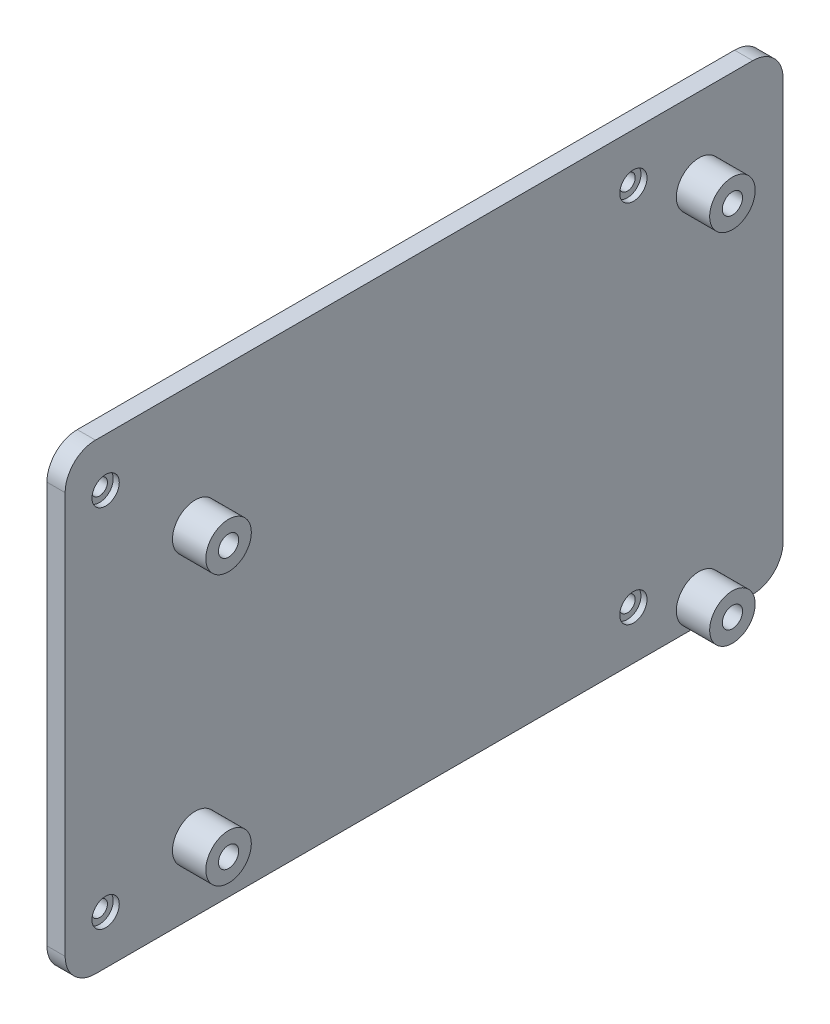
from build123d import *

# Parameters (mm, degrees)
SKETCH1_W            = 133.35
SKETCH1_H            = 76.2
BOSS_EXTRUDE1_DEPTH  = 3
M2_CLEARANCE_HOLE1_D = 2.6
SKETCH7_R            = 3.75
SKETCH7_R_2          = 1.665
BOSS_EXTRUDE2_DEPTH  = 5.5
CUT_EXTRUDE1_DEPTH   = 77.989711163
FILLET1_R            = 5
SKETCH9_R            = 2.25
CUT_EXTRUDE2_DEPTH   = 1


with BuildPart() as part:
    # Sketch1 → Boss-Extrude1 (new body)
    with BuildSketch(Plane(origin=(0, 0, 0), x_dir=(0, 0, -1), z_dir=(1, 0, 0))):
        Rectangle(SKETCH1_W, SKETCH1_H)
    extrude(amount=BOSS_EXTRUDE1_DEPTH)

    # M2 Clearance Hole1 (through all)
    with Locations(Plane(origin=(3, 0, 0), x_dir=(0, 0, -1), z_dir=(1, 0, 0))):
        with Locations((-45, -30.1), (-45, 30.1), (42, 30.1), (42, -30.1)):
            Hole(M2_CLEARANCE_HOLE1_D / 2)

    # Sketch7 → Boss-Extrude2 (add)
    # profile 1 of 4: a face of its own
    with BuildSketch(Plane(origin=(3, 0, 0), x_dir=(0, 0, -1), z_dir=(1, 0, 0))):
        with Locations((-30.23150301, -26.854999996)):
            Circle(SKETCH7_R)
        with Locations((-30.23150301, -26.854999996)):
            Circle(SKETCH7_R_2, mode=Mode.SUBTRACT)
    # profile 2 of 4: a face of its own
    with BuildSketch(Plane(origin=(3, 0, 0), x_dir=(0, 0, -1), z_dir=(1, 0, 0))):
        with Locations((-30.23150301, 17.584000004)):
            Circle(SKETCH7_R)
        with Locations((-30.23150301, 17.584000004)):
            Circle(SKETCH7_R_2, mode=Mode.SUBTRACT)
    # profile 3 of 4: a face of its own
    with BuildSketch(Plane(origin=(3, 0, 0), x_dir=(0, 0, -1), z_dir=(1, 0, 0))):
        with Locations((52.82649699, 24.895000004)):
            Circle(SKETCH7_R)
        with Locations((52.82649699, 24.895000004)):
            Circle(SKETCH7_R_2, mode=Mode.SUBTRACT)
    # profile 4 of 4: a face of its own
    with BuildSketch(Plane(origin=(3, 0, 0), x_dir=(0, 0, -1), z_dir=(1, 0, 0))):
        with Locations((52.82649699, -34.162999996)):
            Circle(SKETCH7_R)
        with Locations((52.82649699, -34.162999996)):
            Circle(SKETCH7_R_2, mode=Mode.SUBTRACT)
    extrude(amount=BOSS_EXTRUDE2_DEPTH)

    # Sketch8 → Cut-Extrude1 (cut, through all)
    with BuildSketch(Plane(origin=(3, 0, 0), x_dir=(0, 0, -1), z_dir=(1, 0, 0))):
        Polygon((-51.675, -329.618471863), (-51.675, -38.1), (-51.675, 38.1), (-51.675, 329.618471863), (-634.711943726, 329.618471863), (-634.711943726, -329.618471863), align=None)
    extrude(amount=-CUT_EXTRUDE1_DEPTH, mode=Mode.SUBTRACT)

    # Fillet1
    fillet1_edges = [part.edges().sort_by_distance(p)[0] for p in [
        (1.5, -38.1, 51.675),
        (1.5, 38.1, 51.675),
        (1.5, -38.1, -66.675),
        (1.5, 38.1, -66.675),
    ]]
    fillet(fillet1_edges, radius=FILLET1_R)

    # Sketch9 → Cut-Extrude2 (cut)
    with BuildSketch(Plane(origin=(3, 0, 0), x_dir=(0, 0, -1), z_dir=(1, 0, 0))):
        with Locations((-45, -30.1)):
            Circle(SKETCH9_R)
        with Locations((-45, 30.1)):
            Circle(SKETCH9_R)
        with Locations((42, 30.1)):
            Circle(SKETCH9_R)
        with Locations((42, -30.1)):
            Circle(SKETCH9_R)
    extrude(amount=-CUT_EXTRUDE2_DEPTH, mode=Mode.SUBTRACT)


solid = part.part
